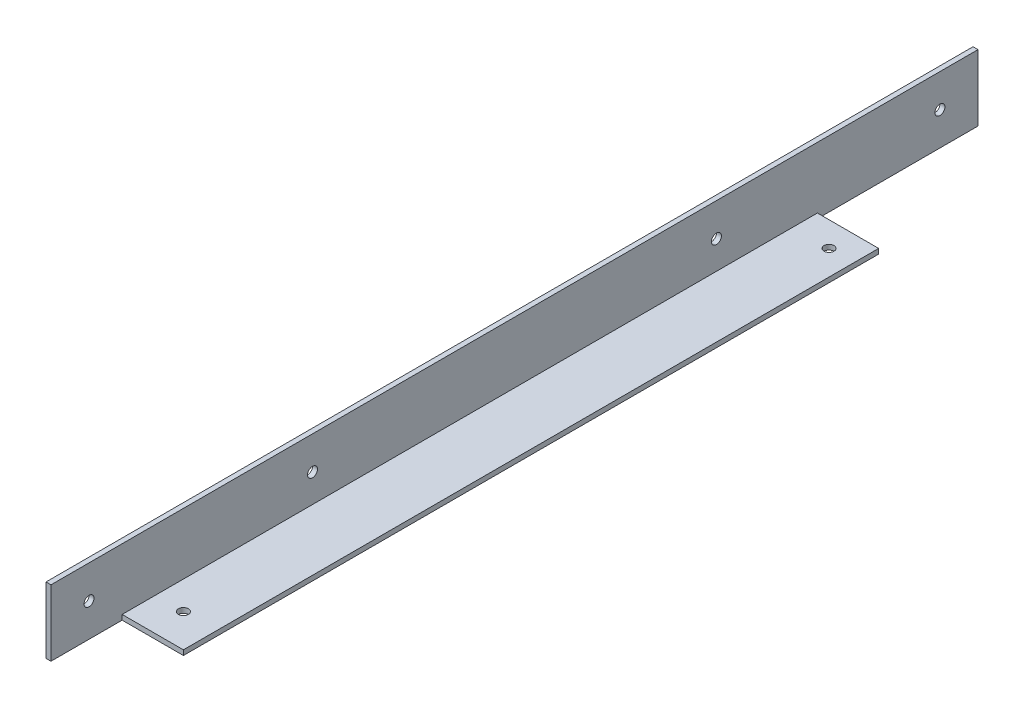
from build123d import *

# Parameters (mm, degrees)
EXTRUSION1_DEPTH = 280
ESQUISSE2_R      = 1.5
EXTRUSION2_DEPTH = 282.322324034
ESQUISSE3_R      = 1.5
EXTRUSION3_DEPTH = 10
ESQUISSE4_W      = 18.5
ESQUISSE4_H      = 48.5
ESQUISSE4_H_2    = 21.5
EXTRUSION4_DEPTH = 1.5


with BuildPart() as part:
    # Esquisse1 → Extrusion1 (new body)
    with BuildSketch(Plane.XY):
        Polygon((0, 0), (20, 0), (20, 1.5), (1.5, 1.5), (1.5, 20), (0, 20), align=None)
    extrude(amount=EXTRUSION1_DEPTH)

    # Esquisse2 → Extrusion2 (cut, through all)
    with BuildSketch(Plane(origin=(0, 1.5, 0), x_dir=(1, 0, 0), z_dir=(0, 1, 0))):
        with Locations(Location((12.5, -56, 0), (0, 0, 180))):
            Circle(ESQUISSE2_R)
        with Locations(Location((10, -248.5, 0), (0, 0, 180))):
            Circle(ESQUISSE2_R)
    extrude(amount=-EXTRUSION2_DEPTH, mode=Mode.SUBTRACT)

    # Esquisse3 → Extrusion3 (cut)
    with BuildSketch(Plane.ZY):
        with Locations(Location((268.5, 10, 0), (0, 0, 270))):
            Circle(ESQUISSE3_R)
        with Locations(Location((11.5, 10, 0), (0, 0, 270))):
            Circle(ESQUISSE3_R)
        with Locations(Location((79, 10, 0), (0, 0, 270))):
            Circle(ESQUISSE3_R)
        with Locations(Location((201, 10, 0), (0, 0, 270))):
            Circle(ESQUISSE3_R)
    extrude(amount=-EXTRUSION3_DEPTH, mode=Mode.SUBTRACT)

    # Esquisse4 → Extrusion4 (cut)
    with BuildSketch(Plane.XZ):
        with Locations((10.75, 24.25)):
            Rectangle(ESQUISSE4_W, ESQUISSE4_H)
        with Locations((10.75, 269.25)):
            Rectangle(ESQUISSE4_W, ESQUISSE4_H_2)
    extrude(amount=-EXTRUSION4_DEPTH, mode=Mode.SUBTRACT)


solid = part.part
